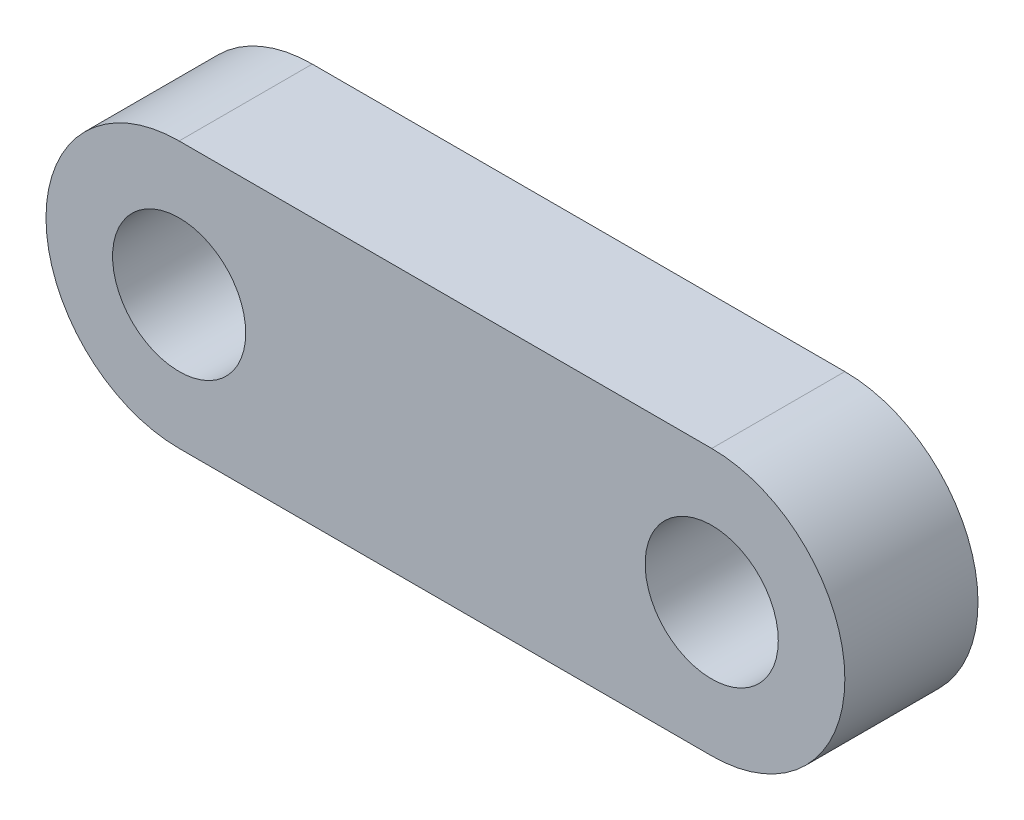
from build123d import *

# Parameters (mm, degrees)
SKETCH1_R           = 1.25
BOSS_EXTRUDE1_DEPTH = 2.5


with BuildPart() as part:
    # Sketch1 → Boss-Extrude1 (new body)
    with BuildSketch(Plane.XY):
        with BuildLine():
            Line((0, 2.5), (10, 2.5))
            ThreePointArc((10, 2.5), (12.5, 0), (10, -2.5))
            Line((10, -2.5), (0, -2.5))
            ThreePointArc((0, -2.5), (-2.5, 0), (0, 2.5))
        make_face()
        Circle(SKETCH1_R, mode=Mode.SUBTRACT)
        with Locations((10, 0)):
            Circle(SKETCH1_R, mode=Mode.SUBTRACT)
    extrude(amount=BOSS_EXTRUDE1_DEPTH)


solid = part.part
